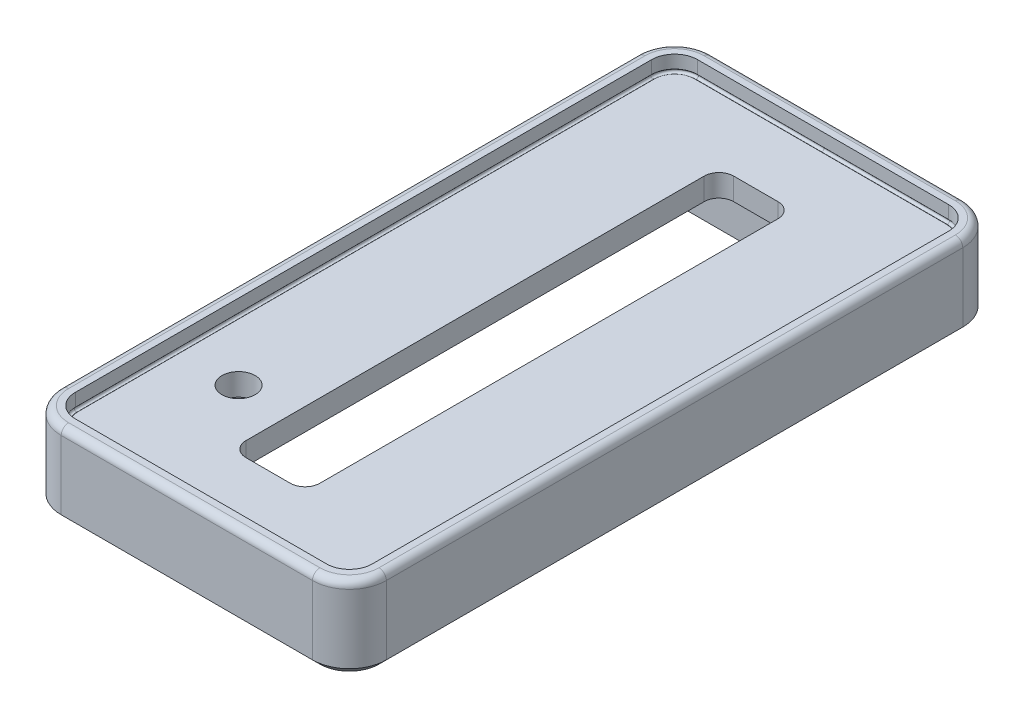
from build123d import *

# Parameters (mm, degrees)
BOSS_EXTRUDE1_DEPTH = 9.2
CUT_EXTRUDE3_DEPTH  = 50.582658259
SKETCH18_R          = 2.25
CUT_EXTRUDE10_DEPTH = 10
BOSS_EXTRUDE3_DEPTH = 2.1
FILLET3_R           = 1
CUT_EXTRUDE8_DEPTH  = 51.04637849
SKETCH13_R          = 0.25
SKETCH17_R          = 3.085
CUT_EXTRUDE9_DEPTH  = 8.2
CHAMFER1_SIZE       = 1


with BuildPart() as part:
    # Sketch1 → Boss-Extrude1 (new body)
    with BuildSketch(Plane(origin=(0, 0, 0), x_dir=(1, 0, 0), z_dir=(0, 1, 0))):
        with BuildLine():
            Line((-17, -44), (17, -44))
            ThreePointArc((17, -44), (20.535533906, -42.535533906), (22, -39))
            Line((22, -39), (22, 39))
            ThreePointArc((22, 39), (20.535533906, 42.535533906), (17, 44))
            Line((17, 44), (-17, 44))
            ThreePointArc((-17, 44), (-20.535533906, 42.535533906), (-22, 39))
            Line((-22, 39), (-22, -39))
            ThreePointArc((-22, -39), (-20.535533906, -42.535533906), (-17, -44))
        make_face()
    extrude(amount=BOSS_EXTRUDE1_DEPTH)

    # Sketch4 → Cut-Extrude3 (cut, through all)
    with BuildSketch(Plane(origin=(0, 6.2, 0), x_dir=(-1, 0, 0), z_dir=(0, -1, 0))):
        with BuildLine():
            Line((-16, -32), (-16, 32))
            ThreePointArc((-16, 32), (-15.121320344, 34.121320344), (-13, 35))
            Line((-13, 35), (13, 35))
            ThreePointArc((13, 35), (15.121320344, 34.121320344), (16, 32))
            Line((16, 32), (16, -32))
            ThreePointArc((16, -32), (15.121320344, -34.121320344), (13, -35))
            Line((13, -35), (-13, -35))
            ThreePointArc((-13, -35), (-15.121320344, -34.121320344), (-16, -32))
        make_face()
    extrude(amount=CUT_EXTRUDE3_DEPTH, mode=Mode.SUBTRACT)

    # Sketch18 → Cut-Extrude10 (cut)
    with BuildSketch(Plane.XZ.offset(-6.2)):
        with Locations(Location((-12, 25, 0), (0, 0, 270))):
            Circle(SKETCH18_R)
        with BuildLine():
            Line((-3, -33), (3, -33))
            ThreePointArc((3, -33), (4.414213562, -32.414213562), (5, -31))
            Line((5, -31), (5, 31))
            ThreePointArc((5, 31), (4.414213562, 32.414213562), (3, 33))
            Line((3, 33), (-3, 33))
            ThreePointArc((-3, 33), (-4.414213562, 32.414213562), (-5, 31))
            Line((-5, 31), (-5, -31))
            ThreePointArc((-5, -31), (-4.414213562, -32.414213562), (-3, -33))
        make_face()
    extrude(amount=-CUT_EXTRUDE10_DEPTH, mode=Mode.SUBTRACT)

    # Sketch9 → Boss-Extrude3 (add)
    with BuildSketch(Plane(origin=(0, 9.2, 0), x_dir=(1, 0, 0), z_dir=(0, 1, 0))):
        with BuildLine():
            Line((-17, -44), (17, -44))
            ThreePointArc((17, -44), (20.535533906, -42.535533906), (22, -39))
            Line((22, -39), (22, 39))
            ThreePointArc((22, 39), (20.535533906, 42.535533906), (17, 44))
            Line((17, 44), (-17, 44))
            ThreePointArc((-17, 44), (-20.535533906, 42.535533906), (-22, 39))
            Line((-22, 39), (-22, -39))
            ThreePointArc((-22, -39), (-20.535533906, -42.535533906), (-17, -44))
        make_face()
        with BuildLine():
            Line((-17, -42), (17, -42))
            ThreePointArc((17, -42), (19.121320344, -41.121320344), (20, -39))
            Line((20, -39), (20, 39))
            ThreePointArc((20, 39), (19.121320344, 41.121320344), (17, 42))
            Line((17, 42), (-17, 42))
            ThreePointArc((-17, 42), (-19.121320344, 41.121320344), (-20, 39))
            Line((-20, 39), (-20, -39))
            ThreePointArc((-20, -39), (-19.121320344, -41.121320344), (-17, -42))
        make_face(mode=Mode.SUBTRACT)
    extrude(amount=BOSS_EXTRUDE3_DEPTH)

    # Fillet3
    fillet3_edges = [part.edges().sort_by_distance(p)[0] for p in [
        (22, 11.3, 0),
        (20.535533906, 11.3, -42.535533906),
        (0, 11.3, -44),
        (-20.535533906, 11.3, -42.535533906),
        (-22, 11.3, 0),
        (-20.535533906, 11.3, 42.535533906),
        (0, 11.3, 44),
        (20.535533906, 11.3, 42.535533906),
    ]]
    fillet(fillet3_edges, radius=FILLET3_R)

    # Sketch12 → Cut-Extrude8 (cut, through all)
    with BuildSketch(Plane(origin=(0, 9.2, 0), x_dir=(1, 0, 0), z_dir=(0, 1, 0))):
        with BuildLine():
            Line((-20.1, 39), (-20.1, -39))
            ThreePointArc((-20.1, -39), (-19.192031022, -41.192031022), (-17, -42.1))
            Line((-17, -42.1), (17, -42.1))
            ThreePointArc((17, -42.1), (19.192031022, -41.192031022), (20.1, -39))
            Line((20.1, -39), (20.1, 39))
            ThreePointArc((20.1, 39), (19.192031022, 41.192031022), (17, 42.1))
            Line((17, 42.1), (-17, 42.1))
            ThreePointArc((-17, 42.1), (-19.192031022, 41.192031022), (-20.1, 39))
        make_face()
        with BuildLine():
            Line((-20, 39), (-20, -39))
            ThreePointArc((-20, -39), (-19.121320344, -41.121320344), (-17, -42))
            Line((-17, -42), (17, -42))
            ThreePointArc((17, -42), (19.121320344, -41.121320344), (20, -39))
            Line((20, -39), (20, 39))
            ThreePointArc((20, 39), (19.121320344, 41.121320344), (17, 42))
            Line((17, 42), (-17, 42))
            ThreePointArc((-17, 42), (-19.121320344, 41.121320344), (-20, 39))
        make_face(mode=Mode.SUBTRACT)
    extrude(amount=CUT_EXTRUDE8_DEPTH, mode=Mode.SUBTRACT)

    # Cut-Sweep1: sweep along a path in Sketch14
    with BuildLine(Plane(origin=(0, 9.2, 0), x_dir=(1, 0, 0), z_dir=(0, 1, 0))) as cut_sweep1_path:
        Line((-20.1, 39), (-20.1, -39))
        ThreePointArc((-20.1, -39), (-19.192031022, -41.192031022), (-17, -42.1))
        Line((-17, -42.1), (17, -42.1))
        ThreePointArc((17, -42.1), (19.192031022, -41.192031022), (20.1, -39))
        Line((20.1, -39), (20.1, 39))
        ThreePointArc((20.1, 39), (19.192031022, 41.192031022), (17, 42.1))
        Line((17, 42.1), (-17, 42.1))
        ThreePointArc((-17, 42.1), (-19.192031022, 41.192031022), (-20.1, 39))
    # Sketch13 → Cut-Sweep1 (sweep, cut)
    with BuildSketch(Plane(origin=(0, 0, 0), x_dir=(0, 0, -1), z_dir=(1, 0, 0))):
        with Locations((41.958578644, 9.341421356)):
            Circle(SKETCH13_R)
    sweep(path=cut_sweep1_path.line, mode=Mode.SUBTRACT)

    # Sketch17 → Cut-Extrude9 (cut)
    with BuildSketch(Plane.XZ):
        with Locations(Location((-16, 38, 0), (0, 0, 270))):
            Circle(SKETCH17_R)
        with Locations(Location((16, 38, 0), (0, 0, 270))):
            Circle(SKETCH17_R)
        with Locations(Location((16, -38, 0), (0, 0, 270))):
            Circle(SKETCH17_R)
        with Locations(Location((-16, -38, 0), (0, 0, 270))):
            Circle(SKETCH17_R)
    extrude(amount=-CUT_EXTRUDE9_DEPTH, mode=Mode.SUBTRACT)

    # Chamfer1
    chamfer1_edges = [part.edges().sort_by_distance(p)[0] for p in [
        (22, 0, 0),
        (20.535533906, 0, 42.535533906),
        (0, 0, 44),
        (-20.535533906, 0, 42.535533906),
        (-22, 0, 0),
        (-20.535533906, 0, -42.535533906),
        (0, 0, -44),
        (20.535533906, 0, -42.535533906),
    ]]
    chamfer(chamfer1_edges, length=CHAMFER1_SIZE)


solid = part.part
